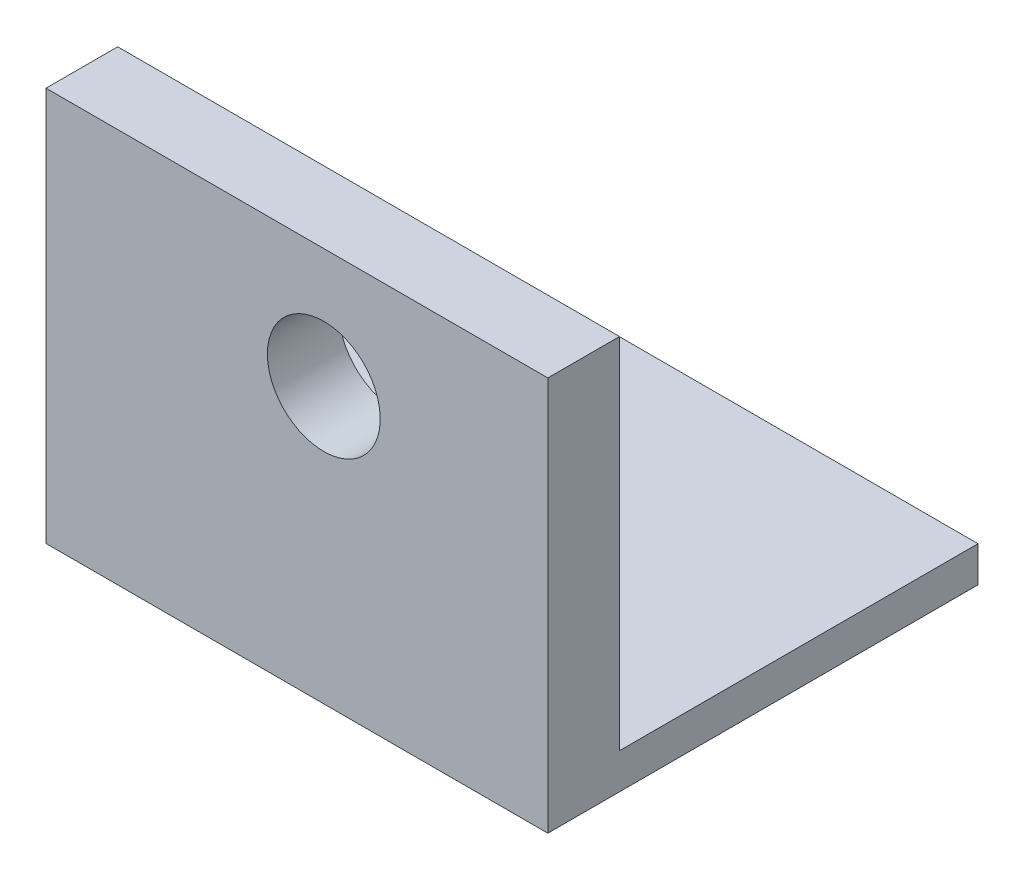
from build123d import *

# Parameters (mm, degrees)
SKETCH1_W               = 140
SKETCH1_H               = 110
BOSS_EXTRUDE1_DEPTH     = 120
CUT_EXTRUDE1_DEPTH      = 215.709105536
CUT_EXTRUDE1_DEPTH_BACK = 100
SKETCH3_R               = 15.739400913
CUT_EXTRUDE2_DEPTH      = 205.205778567


with BuildPart() as part:
    # Sketch1 → Boss-Extrude1 (new body)
    with BuildSketch(Plane.XY):
        with Locations((70, 55)):
            Rectangle(SKETCH1_W, SKETCH1_H)
    extrude(amount=BOSS_EXTRUDE1_DEPTH)

    # Sketch2 → Cut-Extrude1 (cut, two sides: drawn at the far end of the back side and taken through both)
    with BuildSketch(Plane(origin=(0, 0, 0), x_dir=(-1, 0, 0), z_dir=(0, 0, -1)).offset(-CUT_EXTRUDE1_DEPTH_BACK)):
        Polygon((-494.154006157, 9.947538818), (-140, 9.947538818), (0, 9.947538818), (354.154006157, 9.947538818), (354.154006157, 718.255551133), (-494.154006157, 718.255551133), align=None)
    extrude(amount=CUT_EXTRUDE1_DEPTH + CUT_EXTRUDE1_DEPTH_BACK, mode=Mode.SUBTRACT)

    # Sketch3 → Cut-Extrude2 (cut, through all)
    with BuildSketch(Plane(origin=(0, 0, 100), x_dir=(-1, 0, 0), z_dir=(0, 0, -1))):
        with Locations((-77.497780525, 76.701563568)):
            Circle(SKETCH3_R)
    extrude(amount=-CUT_EXTRUDE2_DEPTH, mode=Mode.SUBTRACT)


solid = part.part
